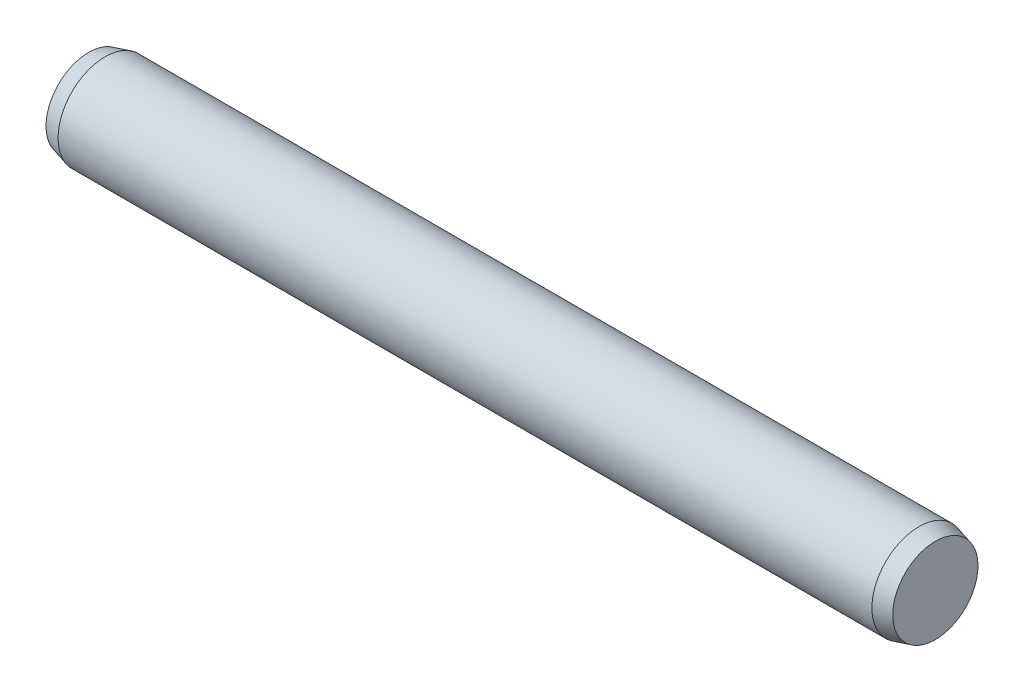
from build123d import *

# Parameters (mm, degrees)
EXTRUDE1_DEPTH      = 8.65
EXTRUDE1_DEPTH_BACK = 8.65
SKETCH2_R           = 1
SKETCH3_R           = 1
EXTRUDE2_DEPTH      = 0.35
EXTRUDE2_TAPER      = 15
SKETCH4_R           = 1
EXTRUDE3_DEPTH      = 0.35
EXTRUDE3_TAPER      = 15


with BuildPart() as part:
    # Sketch2 → Extrude1 (new, two sides: drawn at the far end of the back side and taken through both)
    with BuildSketch(Plane(origin=(0, 0, 0), x_dir=(0, 0, -1), z_dir=(1, 0, 0)).offset(-EXTRUDE1_DEPTH_BACK)):
        Circle(SKETCH2_R)
    extrude(amount=EXTRUDE1_DEPTH + EXTRUDE1_DEPTH_BACK)

    # Sketch3 → Extrude2 (add)
    with BuildSketch(Plane(origin=(8.65, 0, 0), x_dir=(0, 0, -1), z_dir=(1, 0, 0))):
        Circle(SKETCH3_R)
    extrude(amount=EXTRUDE2_DEPTH, taper=EXTRUDE2_TAPER)

    # Sketch4 → Extrude3 (add)
    with BuildSketch(Plane.ZY.offset(8.65)):
        with Locations(Location((0, 0, 0), (0, 0, 180))):
            Circle(SKETCH4_R)
    extrude(amount=EXTRUDE3_DEPTH, taper=EXTRUDE3_TAPER)


solid = part.part
